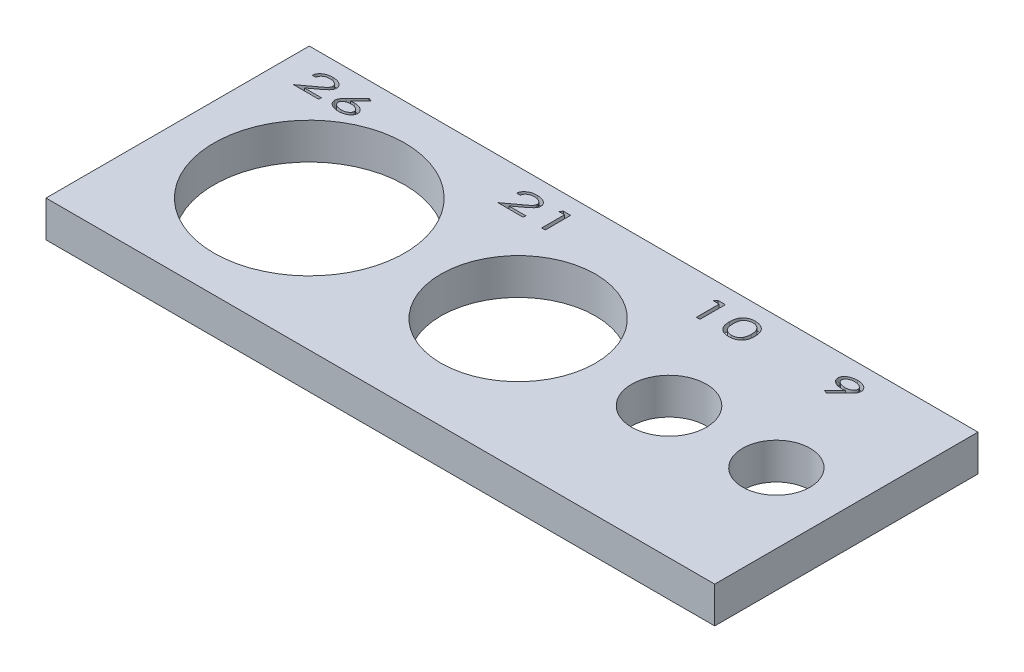
from build123d import *

# Parameters (mm, degrees)
SKETCH_1_R          = 13.15
SKETCH_1_R_2        = 10.65
SKETCH_1_R_3        = 5.15
SKETCH_1_R_4        = 4.65
EXTRUDE_1_DEPTH     = 5
CUT_EXTRUDE_1_DEPTH = 1


with BuildPart() as part:
    # Эскиз1 → Бобышка-Вытянуть1 (new body)
    with BuildSketch(Plane(origin=(0, 0, 0), x_dir=(1, 0, 0), z_dir=(0, 1, 0))):
        Polygon((0, 0), (0, 18.15), (92.2, 18.15), (92.2, -18.15), (0, -18.15), align=None)
        with Locations(Location((18.15, 0, 0), (0, 0, 270))):
            Circle(SKETCH_1_R, mode=Mode.SUBTRACT)
        with Locations(Location((46.95, 0, 0), (0, 0, 270))):
            Circle(SKETCH_1_R_2, mode=Mode.SUBTRACT)
        with Locations(Location((67.75, 0, 0), (0, 0, 270))):
            Circle(SKETCH_1_R_3, mode=Mode.SUBTRACT)
        with Locations(Location((82.55, 0, 0), (0, 0, 270))):
            Circle(SKETCH_1_R_4, mode=Mode.SUBTRACT)
    extrude(amount=EXTRUDE_1_DEPTH)

    # Эскиз2 → Вырез-Вытянуть1 (cut)
    # profile 1 of 7: a face of its own
    with BuildSketch(Plane(origin=(0, 5, 0), x_dir=(1, 0, 0), z_dir=(0, 1, 0))):
        with BuildLine():
            Line((4.187106186, 14.872517632), (3.693516442, 14.872517632))
            add(Edge.make_bspline(
                [(3.693516442, 14.872517632), (3.696387126, 14.914262511), (3.702054408, 14.996674932), (3.729606181, 15.11652193), (3.770489344, 15.230839936), (3.826191593, 15.339225389), (3.896720947, 15.441618342), (3.980397322, 15.538999282), (4.079618601, 15.629423497), (4.191367724, 15.713483313), (4.313342801, 15.790375069), (4.443991302, 15.856819548), (4.581493838, 15.913022517), (4.725571006, 15.959514026), (4.877108682, 15.995057923), (5.035445105, 16.020844372), (5.200839346, 16.036652155), (5.313306052, 16.038329707), (5.370599776, 16.039184299)],
                knots=[0, 0, 0, 0, 0.888834359, 1.754730004, 2.605381666, 3.465737881, 4.338483601, 5.244280611, 6.190581454, 7.187738409, 8.215210836, 9.253401094, 10.301115364, 11.371646232, 12.470031537, 13.608395622, 14.781649024, 16, 16, 16, 16], degree=3))
            add(Edge.make_bspline(
                [(5.370599776, 16.039184299), (5.427188918, 16.038282445), (5.537762267, 16.036520251), (5.699406512, 16.021602823), (5.852547757, 15.99705552), (5.997897879, 15.963872304), (6.134463608, 15.919525552), (6.263344577, 15.866306142), (6.38327923, 15.802233329), (6.494458196, 15.729666595), (6.594451179, 15.65055258), (6.682518467, 15.567265946), (6.757417145, 15.480496162), (6.818085738, 15.389432514), (6.866023275, 15.295234517), (6.899809156, 15.197369353), (6.92004845, 15.095601376), (6.922861761, 15.026621435), (6.924285673, 14.991708337)],
                knots=[0, 0, 0, 0, 1.310756488, 2.561175642, 3.756560902, 4.901738993, 6.011216911, 7.079041313, 8.12778179, 9.156415128, 10.150780717, 11.077522728, 11.960732363, 12.800125033, 13.606405671, 14.402570702, 15.191486623, 16, 16, 16, 16], degree=3))
            add(Edge.make_bspline(
                [(6.924285673, 14.991708337), (6.923462414, 14.96715231), (6.921818319, 14.918112587), (6.913160404, 14.844895434), (6.895536691, 14.773411743), (6.873456189, 14.70252029), (6.84344162, 14.633500888), (6.808773685, 14.564605149), (6.765129242, 14.498449411), (6.716122958, 14.431026921), (6.657132146, 14.361849871), (6.586521247, 14.288307154), (6.503817919, 14.208975876), (6.409655661, 14.122798164), (6.302248849, 14.032549234), (6.183654494, 13.935309918), (6.052216036, 13.833072521), (5.959879586, 13.763672746), (5.911865801, 13.727585741)],
                knots=[0, 0, 0, 0, 0.701848097, 1.40162889, 2.101250406, 2.802272313, 3.520289444, 4.248907007, 5.00269453, 5.781239201, 6.629285482, 7.597407261, 8.692874805, 9.902814045, 11.243302259, 12.700063145, 14.284074618, 16, 16, 16, 16], degree=3))
            Line((5.911865801, 13.727585741), (4.666673494, 12.808415068))
            Line((4.666673494, 12.808415068), (7.014029263, 12.808415068))
            Line((7.014029263, 12.808415068), (7.014029263, 12.449440709))
            Line((7.014029263, 12.449440709), (3.514029263, 12.449440709))
            Line((3.514029263, 12.449440709), (5.475066923, 13.897958337))
            add(Edge.make_bspline(
                [(5.475066923, 13.897958337), (5.522592667, 13.932433784), (5.613780729, 13.998582126), (5.743454403, 14.095401744), (5.860492583, 14.184632777), (5.964103799, 14.267573492), (6.054157489, 14.344031311), (6.132609036, 14.412315622), (6.197237423, 14.474533354), (6.249860252, 14.531226601), (6.293630323, 14.584567919), (6.329775629, 14.637834303), (6.361296581, 14.69145081), (6.386294663, 14.746058797), (6.406291788, 14.801108984), (6.420388953, 14.85699258), (6.42904047, 14.913611784), (6.430145885, 14.951714919), (6.43069593, 14.970674684)],
                knots=[0, 0, 0, 0, 1.894334781, 3.634676748, 5.221274361, 6.642664372, 7.916130238, 9.032651819, 9.997858999, 10.808939575, 11.527303582, 12.221680454, 12.88386773, 13.531644697, 14.156547488, 14.771036415, 15.388479188, 16, 16, 16, 16], degree=3))
            add(Edge.make_bspline(
                [(6.43069593, 14.970674684), (6.42977732, 14.994590791), (6.427958207, 15.041951616), (6.412617648, 15.111404149), (6.387774157, 15.17815902), (6.352818016, 15.242349002), (6.308641464, 15.304569288), (6.25285661, 15.362514965), (6.188699839, 15.418941695), (6.115759921, 15.472247719), (6.035533774, 15.520997731), (5.950168068, 15.563666576), (5.860323373, 15.599667648), (5.766059705, 15.629037898), (5.667218188, 15.652287618), (5.563810523, 15.668031587), (5.456337348, 15.678148452), (5.383243257, 15.679514855), (5.346060513, 15.68020994)],
                knots=[0, 0, 0, 0, 0.804147254, 1.592444627, 2.381369562, 3.194277557, 4.045511985, 4.941362025, 5.894362084, 6.91848291, 7.97738088, 9.050208499, 10.126634048, 11.231141279, 12.370116625, 13.54038185, 14.748799641, 16, 16, 16, 16], degree=3))
            add(Edge.make_bspline(
                [(5.346060513, 15.68020994), (5.307012677, 15.679494723), (5.23042762, 15.678091959), (5.117965143, 15.668322324), (5.010502436, 15.651409758), (4.908062658, 15.628484735), (4.810509212, 15.598890991), (4.717918101, 15.562734604), (4.630677799, 15.518832615), (4.548864682, 15.469447121), (4.473568451, 15.414291467), (4.406536974, 15.352974619), (4.347990117, 15.286323242), (4.298606416, 15.213807949), (4.256672466, 15.136560561), (4.224812167, 15.053211623), (4.200329127, 14.96494788), (4.19157198, 14.90373417), (4.187106186, 14.872517632)],
                knots=[0, 0, 0, 0, 1.20340566, 2.360256049, 3.475759387, 4.553895236, 5.592896754, 6.614780108, 7.613348246, 8.599105318, 9.557104039, 10.48495144, 11.393589009, 12.284641916, 13.183722619, 14.095950191, 15.029010964, 16, 16, 16, 16], degree=3))
        make_face()
    # profile 2 of 7: a face of its own
    with BuildSketch(Plane(origin=(0, 5, 0), x_dir=(1, 0, 0), z_dir=(0, 1, 0))):
        with BuildLine():
            Line((10.370439519, 16.039184299), (10.787606987, 15.861800485))
            Line((10.787606987, 15.861800485), (9.388869007, 14.436419876))
            add(Edge.make_bspline(
                [(9.388869007, 14.436419876), (9.435123979, 14.441283399), (9.526141155, 14.450853488), (9.660756717, 14.461727794), (9.791266629, 14.467169838), (9.876845775, 14.468176565), (9.918917083, 14.468671478)],
                knots=[0, 0, 0, 0, 1.050463357, 2.067025527, 3.049736174, 4, 4, 4, 4], degree=3))
            add(Edge.make_bspline(
                [(9.918917083, 14.468671478), (9.969666305, 14.46772241), (10.069258892, 14.465859916), (10.21564032, 14.451399849), (10.356330742, 14.428684696), (10.491072909, 14.395643624), (10.619976483, 14.353434625), (10.743283848, 14.302299169), (10.860438991, 14.241100468), (10.970611491, 14.17166426), (11.07084442, 14.094976722), (11.160013044, 14.014303301), (11.234111042, 13.927604611), (11.296366719, 13.837746386), (11.343200943, 13.741983158), (11.378485787, 13.642709793), (11.398150643, 13.538352046), (11.401032403, 13.467545868), (11.402490801, 13.431712344)],
                knots=[0, 0, 0, 0, 1.216705803, 2.387718927, 3.523678273, 4.63141966, 5.710670923, 6.773280217, 7.828534494, 8.8764121, 9.891900874, 10.851678986, 11.753718015, 12.621039212, 13.465630922, 14.302152384, 15.140754866, 16, 16, 16, 16], degree=3))
            add(Edge.make_bspline(
                [(11.402490801, 13.431712344), (11.401683824, 13.406921648), (11.400087365, 13.357877737), (11.391357095, 13.284892772), (11.373814008, 13.214325006), (11.351914414, 13.144957189), (11.321603338, 13.078381043), (11.286891747, 13.012292357), (11.243625905, 12.949161603), (11.195504513, 12.887020718), (11.140468379, 12.828547864), (11.080672648, 12.771904065), (11.0150626, 12.718879575), (10.943334978, 12.669780196), (10.867303605, 12.62274651), (10.785274917, 12.579121425), (10.697955257, 12.538670559), (10.57400775, 12.48910521), (10.411702671, 12.43699832), (10.209198838, 12.392201759), (9.999354231, 12.364954467), (9.857065841, 12.361464593), (9.785002821, 12.359697119)],
                knots=[0, 0, 0, 0, 0.694266506, 1.37348081, 2.052663605, 2.727134956, 3.406695774, 4.097501124, 4.814245915, 5.54585583, 6.295811196, 7.059481652, 7.850328824, 8.654300203, 9.491370774, 10.351890412, 11.253438261, 12.184048604, 14.087541303, 16.017718477, 17.98314371, 20, 20, 20, 20], degree=3))
            add(Edge.make_bspline(
                [(9.785002821, 12.359697119), (9.715277165, 12.361214782), (9.577898705, 12.364204991), (9.375781941, 12.390835274), (9.181557183, 12.434413752), (9.025969882, 12.484298173), (8.907634781, 12.533258057), (8.823620296, 12.572838624), (8.744746377, 12.616489181), (8.67089695, 12.663747906), (8.601377569, 12.713785798), (8.537378387, 12.768404808), (8.477583956, 12.825504164), (8.423631444, 12.886648256), (8.375607052, 12.950094304), (8.333303988, 13.014690871), (8.297245777, 13.080232806), (8.267444022, 13.146926441), (8.245169898, 13.215172388), (8.228881369, 13.284340498), (8.218771899, 13.354526311), (8.217319899, 13.40176537), (8.216593366, 13.425402248)],
                knots=[0, 0, 0, 0, 1.997858131, 3.936322594, 5.831264173, 7.697584424, 8.61068666, 9.500618209, 10.358168364, 11.192537912, 12.012558819, 12.811093147, 13.60226001, 14.380531754, 15.145544463, 15.8813147, 16.591828983, 17.287633347, 17.97186184, 18.646181114, 19.322593365, 20, 20, 20, 20], degree=3))
            add(Edge.make_bspline(
                [(8.216593366, 13.425402248), (8.218045066, 13.461528428), (8.221027583, 13.53574964), (8.247467903, 13.647514957), (8.287702904, 13.762046605), (8.334452983, 13.85795756), (8.380483567, 13.937406098), (8.422528108, 14.000571228), (8.470609514, 14.066891646), (8.524809206, 14.136185993), (8.584663054, 14.209284648), (8.652683764, 14.283779692), (8.725204367, 14.36268331), (8.776858486, 14.415075383), (8.803432308, 14.44202885)],
                knots=[0, 0, 0, 0, 1.07928493, 2.21739014, 3.41791122, 4.706067566, 5.401476327, 6.163444467, 6.974466859, 7.851214641, 8.794600008, 9.799511979, 10.867943603, 12, 12, 12, 12], degree=3))
            Line((8.803432308, 14.44202885), (10.370439519, 16.039184299))
        make_face()
        with BuildLine():
            add(Edge.make_bspline(
                [(9.801128622, 14.109697119), (9.763721771, 14.108908938), (9.690200402, 14.107359806), (9.581913597, 14.098566894), (9.478292311, 14.082069923), (9.378733354, 14.060817931), (9.283929172, 14.031756738), (9.193341351, 13.996902559), (9.107315582, 13.955300299), (9.026876045, 13.907904313), (8.952588531, 13.85715173), (8.888800284, 13.801047463), (8.833140104, 13.743992645), (8.788737329, 13.682771874), (8.752817363, 13.619605582), (8.728446034, 13.552984064), (8.712833793, 13.483851217), (8.711075377, 13.4367052), (8.710183109, 13.412782055)],
                knots=[0, 0, 0, 0, 1.260148547, 2.47676148, 3.655814904, 4.792288897, 5.902950622, 6.992061555, 8.05886712, 9.117362627, 10.135025708, 11.083669179, 11.97457227, 12.813789759, 13.624270573, 14.413876465, 15.195158649, 16, 16, 16, 16], degree=3))
            add(Edge.make_bspline(
                [(8.710183109, 13.412782055), (8.711008052, 13.389078313), (8.7126355, 13.342315549), (8.729324482, 13.27372975), (8.754172155, 13.207648448), (8.790290773, 13.144583119), (8.835102132, 13.08371273), (8.891928153, 13.027114082), (8.956847345, 12.971211656), (9.032509322, 12.920448867), (9.114199869, 12.873218503), (9.201074002, 12.831519417), (9.292207158, 12.796336807), (9.387883518, 12.768806815), (9.487275234, 12.745966132), (9.590821721, 12.729946976), (9.698838698, 12.720953614), (9.772132526, 12.719442671), (9.809542083, 12.718671478)],
                knots=[0, 0, 0, 0, 0.795067192, 1.56850922, 2.35898668, 3.160658465, 4.002518143, 4.891065975, 5.84933897, 6.877467259, 7.946991036, 9.018300859, 10.112113065, 11.225373337, 12.360820649, 13.537032575, 14.74288839, 16, 16, 16, 16], degree=3))
            add(Edge.make_bspline(
                [(9.809542083, 12.718671478), (9.846951641, 12.719442671), (9.920245469, 12.720953614), (10.028262446, 12.729946976), (10.131808933, 12.745966132), (10.231200649, 12.768806815), (10.326877009, 12.796336807), (10.418010164, 12.831519417), (10.504884297, 12.873218503), (10.586574845, 12.920448867), (10.662236822, 12.971211656), (10.727156014, 13.027114082), (10.783982035, 13.08371273), (10.828793394, 13.144583119), (10.864912012, 13.207648448), (10.889759685, 13.27372975), (10.906448667, 13.342315549), (10.908076115, 13.389078313), (10.908901058, 13.412782055)],
                knots=[0, 0, 0, 0, 1.25711161, 2.462967425, 3.639179351, 4.774626663, 5.887886935, 6.981699141, 8.053008964, 9.122532741, 10.15066103, 11.108934025, 11.997481857, 12.839341535, 13.64101332, 14.43149078, 15.204932808, 16, 16, 16, 16], degree=3))
            add(Edge.make_bspline(
                [(10.908901058, 13.412782055), (10.90807039, 13.43671653), (10.906431611, 13.483935531), (10.88987991, 13.553032489), (10.864807886, 13.6196154), (10.82830316, 13.683043187), (10.782282088, 13.743727941), (10.726017364, 13.801531704), (10.66001967, 13.857073876), (10.58378168, 13.907951114), (10.501354092, 13.95512435), (10.413820846, 13.996948608), (10.322002424, 14.031605418), (10.226120173, 14.060950729), (10.125573838, 14.081970593), (10.021274864, 14.098532834), (9.912525029, 14.107384602), (9.838769395, 14.108915721), (9.801128622, 14.109697119)],
                knots=[0, 0, 0, 0, 0.797440906, 1.573227087, 2.358328259, 3.165173453, 4.005987165, 4.894092124, 5.851805388, 6.879384734, 7.948399328, 9.019460647, 10.11311689, 11.221031608, 12.362296266, 13.5382162, 14.743642486, 16, 16, 16, 16], degree=3))
        make_face(mode=Mode.SUBTRACT)
    # profile 3 of 7: a face of its own
    with BuildSketch(Plane(origin=(0, 5, 0), x_dir=(1, 0, 0), z_dir=(0, 1, 0))):
        with BuildLine():
            Line((32.366593366, 14.872517632), (31.873003622, 14.872517632))
            add(Edge.make_bspline(
                [(31.873003622, 14.872517632), (31.875874306, 14.914262511), (31.881541588, 14.996674932), (31.90909336, 15.11652193), (31.949976524, 15.230839936), (32.005678773, 15.339225389), (32.076208126, 15.441618342), (32.159884502, 15.538999282), (32.259105781, 15.629423497), (32.370854903, 15.713483313), (32.492829981, 15.790375069), (32.623478481, 15.856819548), (32.760981018, 15.913022517), (32.905058186, 15.959514026), (33.056595861, 15.995057923), (33.214932285, 16.020844372), (33.380326525, 16.036652155), (33.492793231, 16.038329707), (33.550086955, 16.039184299)],
                knots=[0, 0, 0, 0, 0.888834359, 1.754730004, 2.605381666, 3.465737881, 4.338483601, 5.244280611, 6.190581454, 7.187738409, 8.215210836, 9.253401094, 10.301115364, 11.371646232, 12.470031537, 13.608395622, 14.781649024, 16, 16, 16, 16], degree=3))
            add(Edge.make_bspline(
                [(33.550086955, 16.039184299), (33.606676098, 16.038282445), (33.717249446, 16.036520251), (33.878893691, 16.021602823), (34.032034936, 15.99705552), (34.177385059, 15.963872304), (34.313950788, 15.919525552), (34.442831757, 15.866306142), (34.56276641, 15.802233329), (34.673945375, 15.729666595), (34.773938359, 15.65055258), (34.862005647, 15.567265946), (34.936904324, 15.480496162), (34.997572917, 15.389432514), (35.045510455, 15.295234517), (35.079296335, 15.197369353), (35.099535629, 15.095601376), (35.10234894, 15.026621435), (35.103772853, 14.991708337)],
                knots=[0, 0, 0, 0, 1.310756488, 2.561175642, 3.756560902, 4.901738993, 6.011216911, 7.079041313, 8.12778179, 9.156415128, 10.150780717, 11.077522728, 11.960732363, 12.800125033, 13.606405671, 14.402570702, 15.191486623, 16, 16, 16, 16], degree=3))
            add(Edge.make_bspline(
                [(35.103772853, 14.991708337), (35.102949593, 14.96715231), (35.101305499, 14.918112587), (35.092647584, 14.844895434), (35.075023871, 14.773411743), (35.052943369, 14.70252029), (35.022928799, 14.633500888), (34.988260864, 14.564605149), (34.944616421, 14.498449411), (34.895610138, 14.431026921), (34.836619325, 14.361849871), (34.766008427, 14.288307154), (34.683305098, 14.208975876), (34.589142841, 14.122798164), (34.481736028, 14.032549234), (34.363141673, 13.935309918), (34.231703216, 13.833072521), (34.139366766, 13.763672746), (34.091352981, 13.727585741)],
                knots=[0, 0, 0, 0, 0.701848097, 1.40162889, 2.101250406, 2.802272313, 3.520289444, 4.248907007, 5.00269453, 5.781239201, 6.629285482, 7.597407261, 8.692874805, 9.902814045, 11.243302259, 12.700063145, 14.284074618, 16, 16, 16, 16], degree=3))
            Line((34.091352981, 13.727585741), (32.846160673, 12.808415068))
            Line((32.846160673, 12.808415068), (35.193516442, 12.808415068))
            Line((35.193516442, 12.808415068), (35.193516442, 12.449440709))
            Line((35.193516442, 12.449440709), (31.693516442, 12.449440709))
            Line((31.693516442, 12.449440709), (33.654554103, 13.897958337))
            add(Edge.make_bspline(
                [(33.654554103, 13.897958337), (33.702079847, 13.932433784), (33.793267909, 13.998582126), (33.922941582, 14.095401744), (34.039979762, 14.184632777), (34.143590978, 14.267573492), (34.233644669, 14.344031311), (34.312096215, 14.412315622), (34.376724603, 14.474533354), (34.429347431, 14.531226601), (34.473117503, 14.584567919), (34.509262809, 14.637834303), (34.54078376, 14.69145081), (34.565781842, 14.746058797), (34.585778967, 14.801108984), (34.599876133, 14.85699258), (34.60852765, 14.913611784), (34.609633065, 14.951714919), (34.610183109, 14.970674684)],
                knots=[0, 0, 0, 0, 1.894334781, 3.634676748, 5.221274361, 6.642664372, 7.916130238, 9.032651819, 9.997858999, 10.808939575, 11.527303582, 12.221680454, 12.88386773, 13.531644697, 14.156547488, 14.771036415, 15.388479188, 16, 16, 16, 16], degree=3))
            add(Edge.make_bspline(
                [(34.610183109, 14.970674684), (34.6092645, 14.994590791), (34.607445387, 15.041951616), (34.592104827, 15.111404149), (34.567261337, 15.17815902), (34.532305195, 15.242349002), (34.488128644, 15.304569288), (34.432343789, 15.362514965), (34.368187018, 15.418941695), (34.295247101, 15.472247719), (34.215020953, 15.520997731), (34.129655247, 15.563666576), (34.039810553, 15.599667648), (33.945546884, 15.629037898), (33.846705368, 15.652287618), (33.743297702, 15.668031587), (33.635824528, 15.678148452), (33.562730437, 15.679514855), (33.525547692, 15.68020994)],
                knots=[0, 0, 0, 0, 0.804147254, 1.592444627, 2.381369562, 3.194277557, 4.045511985, 4.941362025, 5.894362084, 6.91848291, 7.97738088, 9.050208499, 10.126634048, 11.231141279, 12.370116625, 13.54038185, 14.748799641, 16, 16, 16, 16], degree=3))
            add(Edge.make_bspline(
                [(33.525547692, 15.68020994), (33.486499857, 15.679494723), (33.4099148, 15.678091959), (33.297452322, 15.668322324), (33.189989615, 15.651409758), (33.087549837, 15.628484735), (32.989996391, 15.598890991), (32.89740528, 15.562734604), (32.810164979, 15.518832615), (32.728351862, 15.469447121), (32.65305563, 15.414291467), (32.586024154, 15.352974619), (32.527477297, 15.286323242), (32.478093595, 15.213807949), (32.436159646, 15.136560561), (32.404299346, 15.053211623), (32.379816306, 14.96494788), (32.371059159, 14.90373417), (32.366593366, 14.872517632)],
                knots=[0, 0, 0, 0, 1.20340566, 2.360256049, 3.475759387, 4.553895236, 5.592896754, 6.614780108, 7.613348246, 8.599105318, 9.557104039, 10.48495144, 11.393589009, 12.284641916, 13.183722619, 14.095950191, 15.029010964, 16, 16, 16, 16], degree=3))
        make_face()
    # profile 4 of 7: a face of its own
    with BuildSketch(Plane(origin=(0, 5, 0), x_dir=(1, 0, 0), z_dir=(0, 1, 0))):
        Polygon((37.242334551, 15.949440709), (38.235824135, 15.949440709), (38.235824135, 12.449440709), (37.742234391, 12.449440709), (37.742234391, 15.59046635), (36.934542083, 15.59046635), align=None)
    # profile 5 of 7: a face of its own
    with BuildSketch(Plane(origin=(0, 5, 0), x_dir=(1, 0, 0), z_dir=(0, 1, 0))):
        Polygon((58.574385833, 15.949440709), (59.567875417, 15.949440709), (59.567875417, 12.449440709), (59.074285673, 12.449440709), (59.074285673, 15.59046635), (58.266593366, 15.59046635), align=None)
    # profile 6 of 7: a face of its own
    with BuildSketch(Plane(origin=(0, 5, 0), x_dir=(1, 0, 0), z_dir=(0, 1, 0))):
        with BuildLine():
            add(Edge.make_bspline(
                [(61.892234391, 14.198038466), (61.89295336, 14.254140092), (61.89435051, 14.363160533), (61.903824562, 14.522105565), (61.921388628, 14.671146396), (61.945152254, 14.810413855), (61.974632612, 14.940028588), (62.01282258, 15.059357092), (62.056567267, 15.169430966), (62.108275592, 15.269848089), (62.166605938, 15.361910486), (62.22861983, 15.448917715), (62.298130369, 15.52886772), (62.372083666, 15.603913587), (62.451923458, 15.673191638), (62.537350204, 15.736113092), (62.628680171, 15.793210725), (62.724871229, 15.844924709), (62.825904347, 15.890060391), (62.929673236, 15.930282484), (63.036669719, 15.964112397), (63.14662898, 15.991010796), (63.25932429, 16.013192732), (63.375005262, 16.028329766), (63.493670606, 16.037771587), (63.573740181, 16.038710155), (63.614189519, 16.039184299)],
                knots=[0, 0, 0, 0, 1.403735188, 2.727832326, 3.981926955, 5.156703579, 6.261657675, 7.30470138, 8.288511526, 9.222174616, 10.125912193, 11.013712278, 11.892803487, 12.773546302, 13.648211464, 14.534739601, 15.425462113, 16.341134147, 17.265003812, 18.192419874, 19.124525132, 20.070504313, 21.023524123, 21.996921438, 22.988090027, 24, 24, 24, 24], degree=3))
            add(Edge.make_bspline(
                [(63.614189519, 16.039184299), (63.655339361, 16.038712307), (63.736575032, 16.037780528), (63.856882084, 16.02836303), (63.974386506, 16.013007271), (64.088819378, 15.991322566), (64.200519722, 15.96387874), (64.309171378, 15.930236376), (64.415103159, 15.89041177), (64.517276571, 15.843970556), (64.615977432, 15.792496304), (64.709034101, 15.733190738), (64.797522026, 15.668805872), (64.880959847, 15.598519301), (64.957823497, 15.521129773), (65.029778441, 15.437981536), (65.096404128, 15.348618672), (65.158405245, 15.253191954), (65.214389543, 15.150431113), (65.261740595, 15.038947417), (65.302622899, 14.919521682), (65.335116103, 14.791401011), (65.361316874, 14.654954545), (65.378822471, 14.509931968), (65.390579156, 14.356686425), (65.391673323, 14.251814682), (65.392234391, 14.198038466)],
                knots=[0, 0, 0, 0, 1.018497111, 2.010658934, 2.985171915, 3.950782843, 4.892314633, 5.831069457, 6.764837193, 7.691805427, 8.607950246, 9.518028483, 10.420628394, 11.315481803, 12.215482162, 13.117859548, 14.035428116, 14.972594959, 15.932992342, 16.928152097, 17.967340052, 19.054830013, 20.197432436, 21.404424431, 22.669038684, 24, 24, 24, 24], degree=3))
            add(Edge.make_bspline(
                [(65.392234391, 14.198038466), (65.39166819, 14.144496756), (65.390564129, 14.040093413), (65.378882024, 13.887535439), (65.361121935, 13.743299564), (65.335844966, 13.607497917), (65.304042751, 13.480067329), (65.263654459, 13.36120519), (65.217445057, 13.249980043), (65.161722612, 13.148074973), (65.101511468, 13.052612931), (65.034374676, 12.964403351), (64.962813892, 12.88118257), (64.885618783, 12.803920195), (64.80267912, 12.732824549), (64.713914666, 12.668518182), (64.620425164, 12.608963544), (64.520974135, 12.556804374), (64.417348826, 12.511140141), (64.311287092, 12.469600447), (64.201769247, 12.436705737), (64.089856367, 12.408114724), (63.974852253, 12.386499917), (63.85707513, 12.371502505), (63.736612801, 12.36085184), (63.655345873, 12.360085314), (63.614189519, 12.359697119)],
                knots=[0, 0, 0, 0, 1.326075422, 2.585773043, 3.787839099, 4.924453812, 6.005635817, 7.038185798, 8.031745612, 8.984949921, 9.91162458, 10.825185772, 11.728174756, 12.628785101, 13.52799879, 14.431210449, 15.341905503, 16.271613356, 17.209772702, 18.146233535, 19.091156401, 20.040343789, 21.006609171, 21.987522684, 22.98081259, 24, 24, 24, 24], degree=3))
            add(Edge.make_bspline(
                [(63.614189519, 12.359697119), (63.573741413, 12.360179223), (63.493674275, 12.361133548), (63.375222152, 12.370441581), (63.259878177, 12.385949881), (63.147571916, 12.407083872), (63.037949655, 12.433172096), (62.93192768, 12.467394685), (62.828698064, 12.506651805), (62.728397952, 12.551173437), (62.632591049, 12.602278676), (62.541675799, 12.659103395), (62.456491941, 12.722335067), (62.377452793, 12.792184351), (62.30255253, 12.866719284), (62.232872124, 12.947198874), (62.170105192, 13.034850724), (62.111071991, 13.127618544), (62.05872245, 13.228747363), (62.014024839, 13.339368596), (61.976330909, 13.459467629), (61.945948346, 13.588911769), (61.920907017, 13.727606058), (61.905081595, 13.876169123), (61.894022192, 14.034042601), (61.892840987, 14.142395109), (61.892234391, 14.198038466)],
                knots=[0, 0, 0, 0, 1.013144154, 2.005521627, 2.974303058, 3.927388906, 4.867438012, 5.795098794, 6.716084338, 7.633340424, 8.542205853, 9.434014739, 10.316919509, 11.196498533, 12.074165892, 12.962585908, 13.859645169, 14.772555999, 15.715245058, 16.707881558, 17.757778926, 18.865427691, 20.036877205, 21.286014602, 22.606259698, 24, 24, 24, 24], degree=3))
        make_face()
        with BuildLine():
            add(Edge.make_bspline(
                [(62.385824135, 14.199440709), (62.386062051, 14.152685089), (62.386523967, 14.061908969), (62.394819228, 13.930034219), (62.406131675, 13.806919625), (62.422867642, 13.69266657), (62.444750484, 13.587420781), (62.469925441, 13.490300021), (62.501674512, 13.402540519), (62.537745972, 13.32279412), (62.578761736, 13.249946653), (62.62472539, 13.182550246), (62.674322205, 13.119031238), (62.729466393, 13.060621098), (62.789196884, 13.006709279), (62.85296489, 12.956736432), (62.92152265, 12.911640202), (63.018365973, 12.857959064), (63.145012818, 12.802222358), (63.302925352, 12.754208021), (63.465127441, 12.724382265), (63.575035304, 12.720582589), (63.630315321, 12.718671478)],
                knots=[0, 0, 0, 0, 1.269842302, 2.465401057, 3.587936749, 4.627618279, 5.600016604, 6.50705226, 7.350471098, 8.131749073, 8.882188722, 9.618203836, 10.345958755, 11.06904675, 11.797161553, 12.529911266, 13.267676586, 14.023654412, 15.535876607, 17.015948128, 18.499120702, 20, 20, 20, 20], degree=3))
            add(Edge.make_bspline(
                [(63.630315321, 12.718671478), (63.686081897, 12.720209368), (63.796278311, 12.723248284), (63.958141037, 12.753998227), (64.114895757, 12.799384579), (64.239400543, 12.854849548), (64.334184218, 12.907453853), (64.40158084, 12.951792339), (64.463722032, 13.001858022), (64.522091161, 13.05572437), (64.576027198, 13.114423082), (64.624631896, 13.178407598), (64.670241836, 13.246344869), (64.695754662, 13.294972224), (64.708640641, 13.319532857)],
                knots=[0, 0, 0, 0, 1.541520505, 3.046090383, 4.543945575, 6.049668695, 6.805351412, 7.542571016, 8.278882295, 9.011092164, 9.738918961, 10.481424375, 11.23300009, 12, 12, 12, 12], degree=3))
            add(Edge.make_bspline(
                [(64.708640641, 13.319532857), (64.724067241, 13.350636455), (64.755119579, 13.413245159), (64.79352831, 13.512042224), (64.825575918, 13.615235737), (64.852253558, 13.722922518), (64.873456818, 13.835243186), (64.887715112, 13.952590567), (64.89730051, 14.074481114), (64.898191942, 14.157354324), (64.898644648, 14.199440709)],
                knots=[0, 0, 0, 0, 0.916501938, 1.844834726, 2.795466895, 3.768435452, 4.773126038, 5.811927813, 6.888807996, 8, 8, 8, 8], degree=3))
            add(Edge.make_bspline(
                [(64.898644648, 14.199440709), (64.898054764, 14.241517408), (64.896900202, 14.323872927), (64.889397492, 14.444421551), (64.875798218, 14.559009962), (64.858272677, 14.668091698), (64.83319405, 14.770840893), (64.804866609, 14.868282254), (64.770511615, 14.959748077), (64.730282655, 15.045202629), (64.686411765, 15.125330215), (64.63755909, 15.199413752), (64.585042148, 15.268019836), (64.528875012, 15.33186085), (64.46766414, 15.389069061), (64.40295696, 15.441401745), (64.33398928, 15.487866777), (64.237079279, 15.541345755), (64.11096232, 15.596415275), (63.954865371, 15.645636089), (63.793791361, 15.674279947), (63.685112869, 15.678222193), (63.630315321, 15.68020994)],
                knots=[0, 0, 0, 0, 1.143048628, 2.237256344, 3.279101487, 4.276898645, 5.236246244, 6.150216925, 7.03222975, 7.887138624, 8.714055636, 9.511721569, 10.295188532, 11.05967358, 11.818682171, 12.568259394, 13.318374141, 14.07437643, 15.572468509, 17.048388297, 18.51174707, 20, 20, 20, 20], degree=3))
            add(Edge.make_bspline(
                [(63.630315321, 15.68020994), (63.574584917, 15.678225999), (63.464283327, 15.674299383), (63.301313906, 15.645806921), (63.144215795, 15.596600089), (63.018332842, 15.541305033), (62.921987468, 15.488776677), (62.854364931, 15.443223603), (62.790606008, 15.394086356), (62.732265469, 15.339155196), (62.677072748, 15.281316414), (62.627511882, 15.217736299), (62.581630704, 15.150163421), (62.539871693, 15.077523456), (62.502869393, 14.99792577), (62.471730799, 14.910037876), (62.444919483, 14.813295666), (62.423908865, 14.707511792), (62.405937466, 14.593202491), (62.394824258, 14.469774513), (62.386515616, 14.337675554), (62.38605919, 14.246430837), (62.385824135, 14.199440709)],
                knots=[0, 0, 0, 0, 1.513772308, 2.996057509, 4.478206715, 5.976466197, 6.723919043, 7.456499242, 8.189354548, 8.90821345, 9.631405645, 10.359265438, 11.095386615, 11.849070134, 12.633113281, 13.47665366, 14.379365024, 15.358122331, 16.405178713, 17.521556336, 18.723626006, 20, 20, 20, 20], degree=3))
        make_face(mode=Mode.SUBTRACT)
    # profile 7 of 7: a face of its own
    with BuildSketch(Plane(origin=(0, 5, 0), x_dir=(1, 0, 0), z_dir=(0, 1, 0))):
        with BuildLine():
            Line((77.103772853, 12.359697119), (76.674686314, 12.526564107))
            Line((76.674686314, 12.526564107), (78.123203942, 13.953346959))
            add(Edge.make_bspline(
                [(78.123203942, 13.953346959), (78.031633036, 13.946510849), (77.853319342, 13.933199064), (77.674523988, 13.931188165), (77.587546891, 13.93020994)],
                knots=[0, 0, 0, 0, 1.027076546, 2, 2, 2, 2], degree=3))
            add(Edge.make_bspline(
                [(77.587546891, 13.93020994), (77.535863724, 13.931165228), (77.434174245, 13.933044809), (77.284531489, 13.94749951), (77.140560522, 13.970118562), (77.002798494, 14.003238937), (76.871116033, 14.045470826), (76.745133637, 14.09637315), (76.62562417, 14.157979115), (76.512904669, 14.22701753), (76.410449944, 14.303661771), (76.31998332, 14.384849129), (76.243305013, 14.471029562), (76.18059049, 14.561638416), (76.131173041, 14.656644734), (76.096782277, 14.756324444), (76.075797081, 14.860423061), (76.07309047, 14.931314783), (76.071721571, 14.967169075)],
                knots=[0, 0, 0, 0, 1.222262092, 2.404867977, 3.552660741, 4.666829587, 5.752438782, 6.821040512, 7.876681517, 8.929061029, 9.94397039, 10.898861243, 11.79954064, 12.665876293, 13.499038982, 14.324186141, 15.152438147, 16, 16, 16, 16], degree=3))
            add(Edge.make_bspline(
                [(76.071721571, 14.967169075), (76.072427014, 14.991976), (76.073823469, 15.041082398), (76.084005332, 15.113581756), (76.099989177, 15.184338275), (76.123369893, 15.25301048), (76.152953291, 15.320230646), (76.189587199, 15.385326256), (76.232531005, 15.448625021), (76.281850451, 15.50975071), (76.337232753, 15.568507264), (76.39819101, 15.624451709), (76.464614159, 15.677560838), (76.536917868, 15.726825771), (76.614193348, 15.774424426), (76.697792494, 15.817286066), (76.786371483, 15.858179012), (76.911777183, 15.908692442), (77.076360521, 15.960954098), (77.280830494, 16.006830181), (77.492634435, 16.033908372), (77.636080643, 16.037408783), (77.708840962, 16.039184299)],
                knots=[0, 0, 0, 0, 0.689343105, 1.364584941, 2.031146893, 2.702879979, 3.377621682, 4.069774953, 4.77605033, 5.50142564, 6.250498032, 7.01826534, 7.799436353, 8.612087454, 9.44876297, 10.32041575, 11.221466994, 12.159955568, 14.076676044, 16.013599651, 17.977975401, 20, 20, 20, 20], degree=3))
            add(Edge.make_bspline(
                [(77.708840962, 16.039184299), (77.779961305, 16.037348755), (77.920109854, 16.033731662), (78.126077081, 16.007666814), (78.323636348, 15.963196043), (78.481388458, 15.911903218), (78.601519471, 15.862357841), (78.686285984, 15.821499189), (78.766802121, 15.778301), (78.841794284, 15.730421845), (78.912082683, 15.679193358), (78.977509919, 15.624685178), (79.0372476, 15.56586529), (79.092505771, 15.504873024), (79.141329399, 15.441059314), (79.184491033, 15.376346818), (79.221311668, 15.310420139), (79.250554, 15.242847716), (79.274149773, 15.174754412), (79.290135218, 15.105403088), (79.300364777, 15.035014825), (79.301779463, 14.987536648), (79.302490801, 14.963663466)],
                knots=[0, 0, 0, 0, 2.011902085, 3.964620344, 5.862280425, 7.733679187, 8.649705516, 9.536929122, 10.39496919, 11.233241263, 12.051882161, 12.854450678, 13.639978519, 14.421908312, 15.181028786, 15.910905137, 16.621201237, 17.314048802, 17.991518398, 18.657106495, 19.32476047, 20, 20, 20, 20], degree=3))
            add(Edge.make_bspline(
                [(79.302490801, 14.963663466), (79.300776563, 14.926837461), (79.29727922, 14.851706064), (79.270852009, 14.738253544), (79.230205997, 14.622126011), (79.182032564, 14.525022017), (79.135206651, 14.444954899), (79.092724967, 14.380918227), (79.043939712, 14.313924358), (78.98769868, 14.244429508), (78.926707196, 14.170865137), (78.857983022, 14.095258956), (78.783985612, 14.015699074), (78.731026088, 13.962985474), (78.703732789, 13.935818914)],
                knots=[0, 0, 0, 0, 1.085757783, 2.21513306, 3.421143454, 4.710222576, 5.405613291, 6.157227374, 6.976492062, 7.849860849, 8.79455011, 9.795544387, 10.863908438, 12, 12, 12, 12], degree=3))
            Line((78.703732789, 13.935818914), (77.103772853, 12.359697119))
        make_face()
        with BuildLine():
            add(Edge.make_bspline(
                [(77.696220769, 14.289184299), (77.734797683, 14.289960349), (77.810422736, 14.291481694), (77.921714605, 14.300400405), (78.028272225, 14.316533266), (78.129859745, 14.33901716), (78.226876975, 14.366843904), (78.318838016, 14.40223256), (78.406510526, 14.443252968), (78.48829566, 14.490809516), (78.56245428, 14.542866468), (78.628468895, 14.59722524), (78.683594025, 14.655453867), (78.72983588, 14.715610864), (78.765365325, 14.779161535), (78.789875512, 14.845461235), (78.806395855, 14.914011457), (78.808061071, 14.960996433), (78.808901058, 14.984697119)],
                knots=[0, 0, 0, 0, 1.283158803, 2.515466951, 3.710435794, 4.864663788, 5.974048071, 7.063981457, 8.138421143, 9.19032707, 10.206025528, 11.149527362, 12.029233889, 12.867185432, 13.667480401, 14.439882982, 15.213028351, 16, 16, 16, 16], degree=3))
            add(Edge.make_bspline(
                [(78.808901058, 14.984697119), (78.808026901, 15.008384901), (78.806293945, 15.055344295), (78.790236112, 15.124249125), (78.763664235, 15.19007471), (78.727960258, 15.253738245), (78.680519926, 15.313550695), (78.623941671, 15.371385425), (78.557173558, 15.426879984), (78.480255742, 15.477745218), (78.396990967, 15.525131167), (78.308167494, 15.566705497), (78.214801494, 15.601630574), (78.117086519, 15.630411262), (78.015159797, 15.652744353), (77.909103336, 15.669018078), (77.79850305, 15.677907001), (77.723345586, 15.679431959), (77.685002821, 15.68020994)],
                knots=[0, 0, 0, 0, 0.782754581, 1.551756972, 2.325602361, 3.125392172, 3.957417824, 4.843138528, 5.798408914, 6.823408541, 7.889794956, 8.965474006, 10.064027196, 11.184481147, 12.332524092, 13.513445661, 14.731445064, 16, 16, 16, 16], degree=3))
            add(Edge.make_bspline(
                [(77.685002821, 15.68020994), (77.647126952, 15.679430687), (77.572669022, 15.677898799), (77.462779118, 15.668955783), (77.357164897, 15.652829055), (77.255721103, 15.630397445), (77.158691164, 15.601654482), (77.065871782, 15.566547915), (76.977214756, 15.525148279), (76.893958333, 15.477740836), (76.817038398, 15.426881055), (76.750270801, 15.371385168), (76.693692422, 15.313550757), (76.646252121, 15.25373823), (76.610548135, 15.190074714), (76.583976261, 15.124249124), (76.567918427, 15.055344295), (76.566185471, 15.008384901), (76.565311314, 14.984697119)],
                knots=[0, 0, 0, 0, 1.25666156, 2.470396666, 3.654675398, 4.798411963, 5.91461662, 7.009038651, 8.087775677, 9.15719365, 10.18510718, 11.143093239, 12.031331899, 12.86572286, 13.667786341, 14.443831643, 15.215020178, 16, 16, 16, 16], degree=3))
            add(Edge.make_bspline(
                [(76.565311314, 14.984697119), (76.566085936, 14.960981264), (76.5676233, 14.913913286), (76.58515317, 14.845455054), (76.610107514, 14.778889664), (76.647441257, 14.715879229), (76.694051679, 14.65468157), (76.752235607, 14.597788701), (76.819595655, 14.542362017), (76.896569478, 14.490873499), (76.980898201, 14.443370539), (77.070653506, 14.40238612), (77.164361597, 14.366663331), (77.262677965, 14.339354294), (77.364855546, 14.316479682), (77.471432214, 14.30041496), (77.582485809, 14.291498233), (77.657877385, 14.289964394), (77.696220769, 14.289184299)],
                knots=[0, 0, 0, 0, 0.779493762, 1.54703233, 2.314841165, 3.115123074, 3.949777311, 4.842629488, 5.789016065, 6.820433677, 7.889083008, 8.974246054, 10.068222863, 11.189256494, 12.332516893, 13.516131016, 14.736729643, 16, 16, 16, 16], degree=3))
        make_face(mode=Mode.SUBTRACT)
    extrude(amount=-CUT_EXTRUDE_1_DEPTH, mode=Mode.SUBTRACT)


solid = part.part
